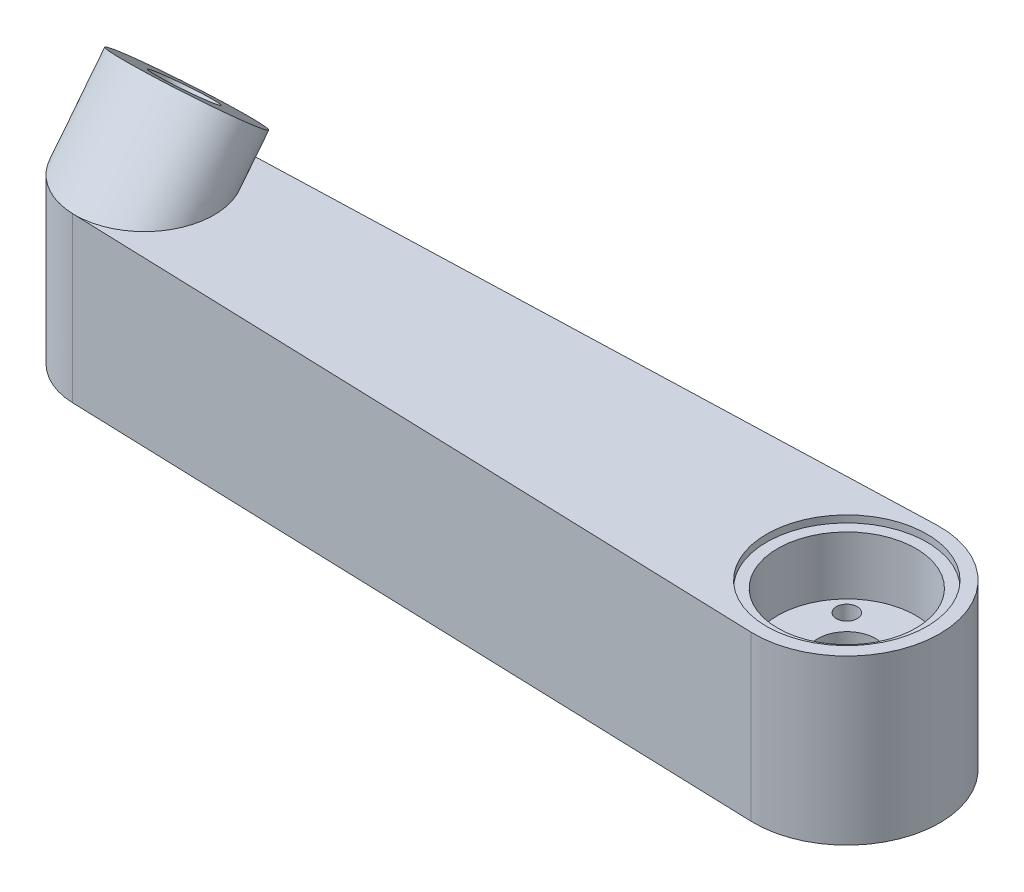
from build123d import *

# Parameters (mm, degrees)
BOSS_EXTRUDE1_DEPTH = 14.11
SKETCH2_R           = 5.95
CUT_EXTRUDE1_DEPTH  = 5.6
SKETCH3_R           = 6.9
CUT_EXTRUDE2_DEPTH  = 0.6
SKETCH4_R           = 2.5
CUT_EXTRUDE3_DEPTH  = 70.144106761
SKETCH5_R           = 0.9
CUT_EXTRUDE4_DEPTH  = 4.4
SKETCH6_R           = 6
CUT_EXTRUDE6_DEPTH  = 2.5
BOSS_EXTRUDE5_DEPTH = 0.4
BOSS_EXTRUDE6_REACH = 73.866
SKETCH13_RX         = 6
SKETCH13_RY         = 4.596266659
SKETCH14_R          = 2.5
CUT_EXTRUDE8_DEPTH  = 8


with BuildPart() as part:
    # Sketch1 → Boss-Extrude1 (new body)
    with BuildSketch(Plane(origin=(0, 0, 0), x_dir=(1, 0, 0), z_dir=(0, 1, 0))):
        with BuildLine():
            Line((-62.34882326, 5.996720639), (-1.914938962, 7.995627519))
            ThreePointArc((-1.914938962, 7.995627519), (6.349523848, 0), (-1.914938962, -7.995627519))
            Line((-1.914938962, -7.995627519), (-62.34882326, -5.996720639))
            ThreePointArc((-62.34882326, -5.996720639), (-68.150476152, 0), (-62.34882326, 5.996720639))
        make_face()
    extrude(amount=BOSS_EXTRUDE1_DEPTH)

    # Sketch2 → Cut-Extrude1 (cut)
    with BuildSketch(Plane(origin=(0, 14.11, 0), x_dir=(1, 0, 0), z_dir=(0, 1, 0))):
        with Locations(Location((-1.650476152, 0, 0), (0, 0, 270))):
            Circle(SKETCH2_R)
    extrude(amount=-CUT_EXTRUDE1_DEPTH, mode=Mode.SUBTRACT)

    # Sketch3 → Cut-Extrude2 (cut)
    with BuildSketch(Plane(origin=(0, 14.11, 0), x_dir=(1, 0, 0), z_dir=(0, 1, 0))):
        with Locations(Location((-1.650476152, 0, 0), (0, 0, 270))):
            Circle(SKETCH3_R)
    extrude(amount=-CUT_EXTRUDE2_DEPTH, mode=Mode.SUBTRACT)

    # Sketch4 → Cut-Extrude3 (cut, through all)
    with BuildSketch(Plane(origin=(0, 8.51, 0), x_dir=(1, 0, 0), z_dir=(0, 1, 0))):
        with Locations(Location((-1.650476152, 0, 0), (0, 0, 270))):
            Circle(SKETCH4_R)
    extrude(amount=-CUT_EXTRUDE3_DEPTH, mode=Mode.SUBTRACT)

    # Sketch5 → Cut-Extrude4 (cut)
    with BuildSketch(Plane(origin=(0, 8.51, 0), x_dir=(1, 0, 0), z_dir=(0, 1, 0))):
        with Locations(Location((-4.832456668, 3.181980515, 0), (0, 0, 270))):
            Circle(SKETCH5_R)
    extrude(amount=-CUT_EXTRUDE4_DEPTH, mode=Mode.SUBTRACT)

    # Sketch6 → Cut-Extrude6 (cut)
    with BuildSketch(Plane.XZ):
        with Locations(Location((-1.650476152, 0, 0), (0, 0, 270))):
            Circle(SKETCH6_R)
    extrude(amount=-CUT_EXTRUDE6_DEPTH, mode=Mode.SUBTRACT)

    # Sketch10 → Boss-Extrude5 (add)
    with BuildSketch(Plane.XZ.offset(-2.5)):
        with BuildLine():
            Line((0.75768614, -0.671382434), (4.34720185, -0.1669089))
            ThreePointArc((4.34720185, -0.1669089), (4.29113226, 0.835038606), (4.068855648, 1.813627238))
            Line((4.068855648, 1.813627238), (0.479339938, 1.309153704))
            ThreePointArc((0.479339938, 1.309153704), (0.82519402, 0.347932752), (0.75768614, -0.671382434))
        make_face()
        with BuildLine():
            Line((-7.648154155, 0.1669089), (-4.058638445, 0.671382434))
            ThreePointArc((-4.058638445, 0.671382434), (-4.126146324, -0.347932752), (-3.780292243, -1.309153704))
            Line((-3.780292243, -1.309153704), (-7.369807953, -1.813627238))
            ThreePointArc((-7.369807953, -1.813627238), (-7.592084565, -0.835038606), (-7.648154155, 0.1669089))
        make_face()
    extrude(amount=BOSS_EXTRUDE5_DEPTH)

    # Boss-Extrude6: up to this plane
    boss_extrude6_end = Plane(origin=(-1.650476152, 14.11, 0), z_dir=(0, 1, 0))
    # Sketch13 → Boss-Extrude6 (add, up to the surface)
    with BuildSketch(Plane(origin=(-0.382193209, 13.778273936, -11.555025608), x_dir=(0.9997443283307086, 0.02124917717972034, -0.007729840862870826), z_dir=(-0.02124917717972034, 0.766044443118977, -0.6424362876081342)), mode=Mode.PRIVATE) as boss_extrude6_sk1:
        with Locations(Location((-61.834760146, -9.545189308), (0, 0, -178.105579493))):
            Ellipse(SKETCH13_RX, SKETCH13_RY)
    boss_extrude6_tool1 = split(extrude(boss_extrude6_sk1.sketch, amount=-BOSS_EXTRUDE6_REACH, mode=Mode.PRIVATE), bisect_by=boss_extrude6_end, keep=Keep.BOTH, mode=Mode.PRIVATE)
    add(boss_extrude6_tool1.solids().sort_by_distance((-62.274927, 18.596512, -3.762573))[0])

    # Sketch14 → Cut-Extrude8 (cut)
    with BuildSketch(Plane(origin=(-0.382193209, 13.778273936, -11.555025608), x_dir=(0.9997742107441985, 0.01628149028495012, -0.013654325502060603), z_dir=(-0.02124917717972034, 0.766044443118977, -0.6424362876081342))):
        with Locations(Location((-62.096233495, -9.094616235, 0), (0, 0, 270))):
            Circle(SKETCH14_R)
    extrude(amount=-CUT_EXTRUDE8_DEPTH, mode=Mode.SUBTRACT)


solid = part.part
